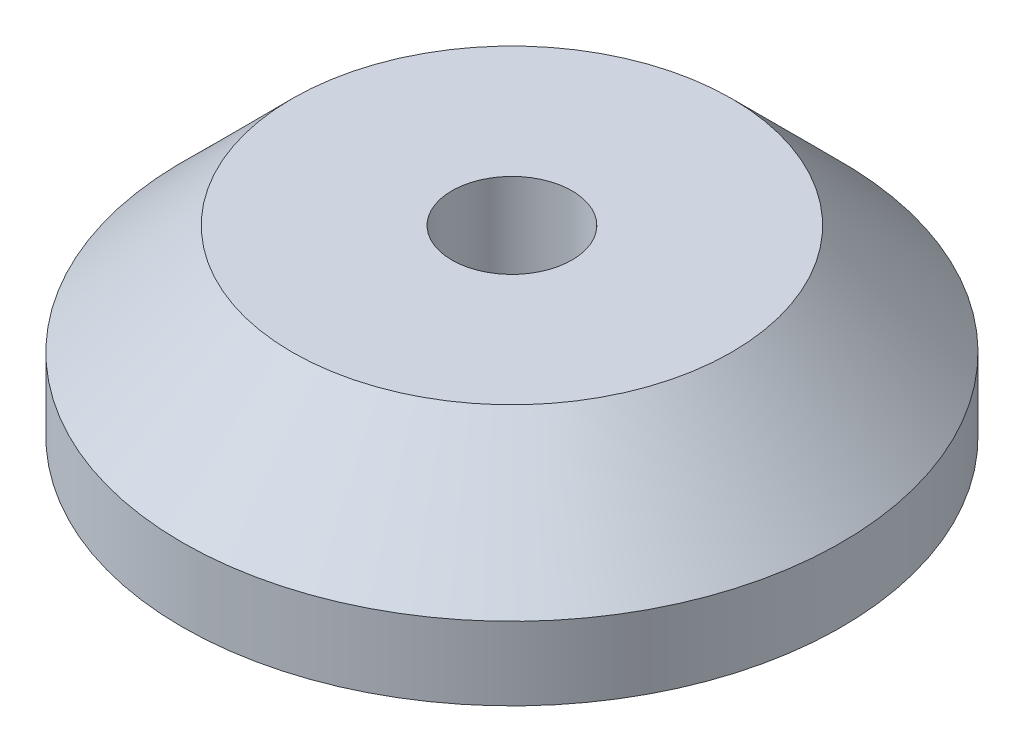
from build123d import *

# Parameters (mm, degrees)
SKETCH2_R           = 22.5
BOSS_EXTRUDE1_DEPTH = 5
SKETCH3_R           = 22.5
BOSS_EXTRUDE2_DEPTH = 7.5
BOSS_EXTRUDE2_TAPER = 45
SKETCH4_R           = 4.1
CUT_EXTRUDE1_DEPTH  = 35.18698596


with BuildPart() as part:
    # Sketch2 → Boss-Extrude1 (new body)
    with BuildSketch(Plane(origin=(0, 0, 0), x_dir=(1, 0, 0), z_dir=(0, 1, 0))):
        with Locations(Location((0, 0, 0), (0, 0, 270))):
            Circle(SKETCH2_R)
    extrude(amount=BOSS_EXTRUDE1_DEPTH)


with BuildPart() as body_2:
    # Sketch3 → Boss-Extrude2 (new body)
    with BuildSketch(Plane(origin=(0, 5, 0), x_dir=(1, 0, 0), z_dir=(0, 1, 0))):
        with Locations(Location((0, 0, 0), (0, 0, 270))):
            Circle(SKETCH3_R)
    extrude(amount=BOSS_EXTRUDE2_DEPTH, taper=BOSS_EXTRUDE2_TAPER)


with BuildPart() as cut_extrude1_tool:
    # Sketch4 → Cut-Extrude1 (new, through all)
    with BuildSketch(Plane(origin=(0, 12.5, 0), x_dir=(1, 0, 0), z_dir=(0, 1, 0))):
        with Locations(Location((0, 0, 0), (0, 0, 270))):
            Circle(SKETCH4_R)
    extrude(amount=-CUT_EXTRUDE1_DEPTH)


with BuildPart() as part_1:
    add(part.part)

    # Cut-Extrude1: cut by cut_extrude1_tool
    add(cut_extrude1_tool.part, mode=Mode.SUBTRACT)


with BuildPart() as body_2_1:
    add(body_2.part)

    # Cut-Extrude1: cut by cut_extrude1_tool
    add(cut_extrude1_tool.part, mode=Mode.SUBTRACT)


solid = Compound([part_1.part, body_2_1.part])
